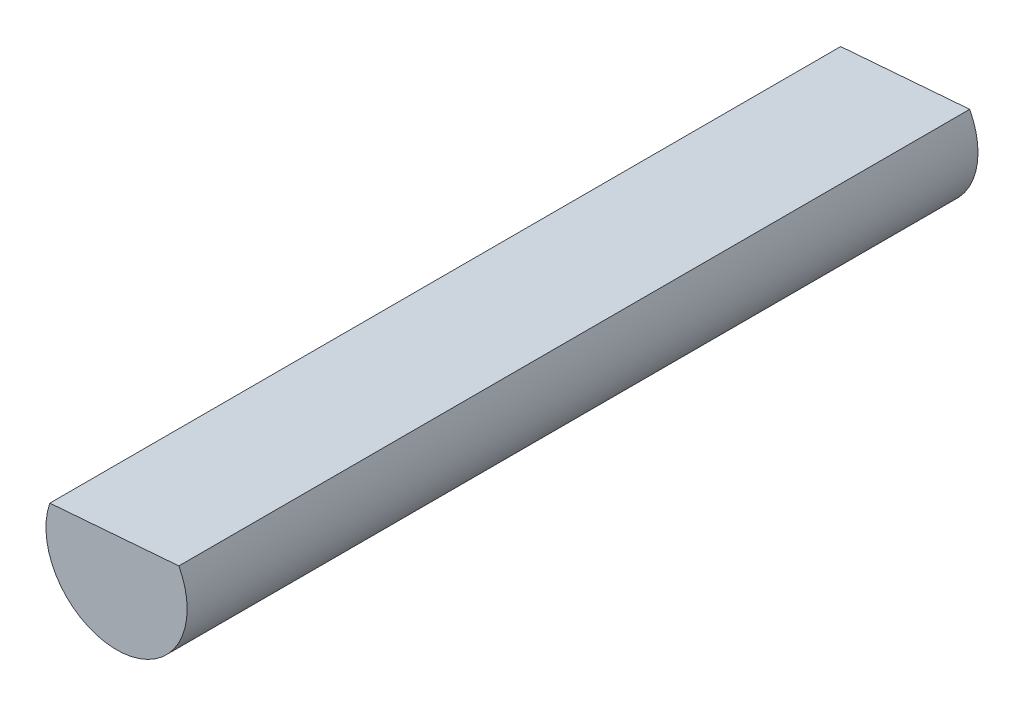
from build123d import *

# Parameters (mm, degrees)
EXTRUDE_1_DEPTH = 56


with BuildPart() as part:
    # 草图1 → 凸台-拉伸1 (new body)
    with BuildSketch(Plane.XY):
        with BuildLine():
            Line((4.411530952, 2.353379413), (-4.725367335, 1.634289922))
            ThreePointArc((-4.725367335, 1.634289922), (0.392295479, -4.984586669), (4.411530952, 2.353379413))
        make_face()
    extrude(amount=EXTRUDE_1_DEPTH)


solid = part.part
